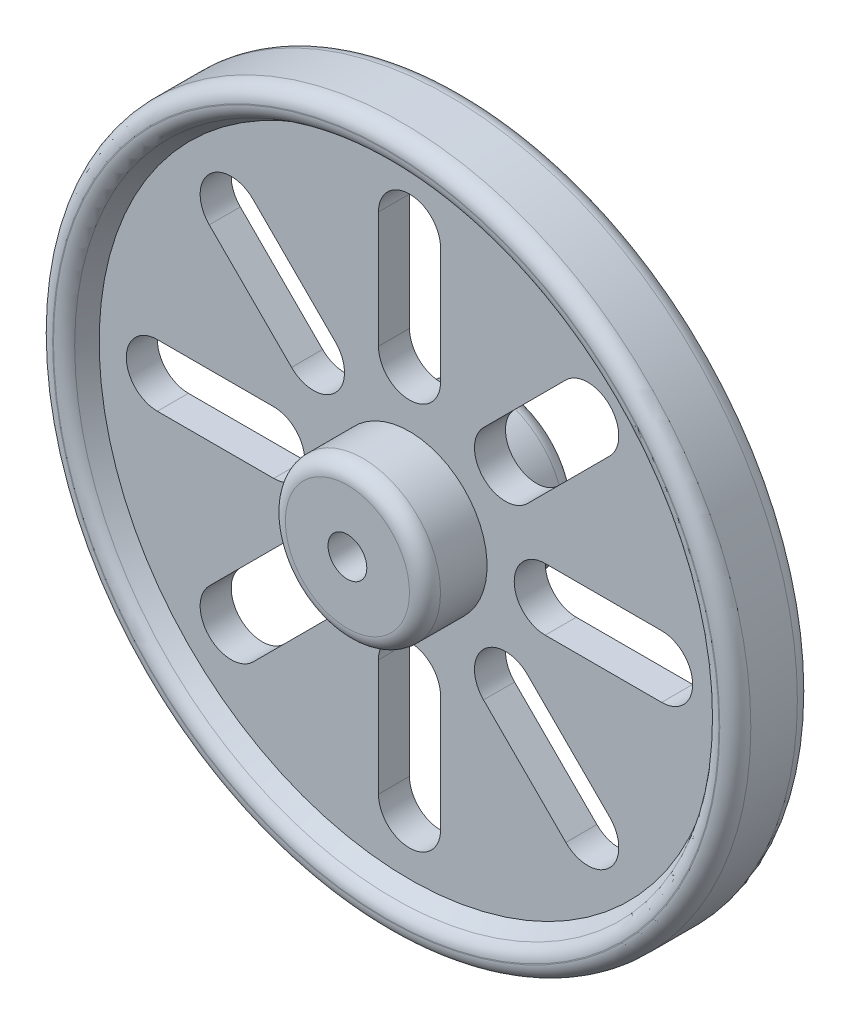
from build123d import *

# Parameters (mm, degrees)
SKETCH1_R                = 10
BOSS_EXTRUDE1_DEPTH      = 10
CUT_EXTRUDE1_DEPTH       = 10
CIRPATTERN1_COUNT        = 8
FILLET1_R                = 2
F_5_0_5_DIAMETER_HOLE1_D = 5


with BuildPart() as part:
    # Sketch1 → Boss-Extrude1 (new, symmetric)
    with BuildSketch(Plane.XY):
        Circle(SKETCH1_R)
    extrude(amount=BOSS_EXTRUDE1_DEPTH, both=True)

    # Sketch2 → Revolve1 (revolve)
    with BuildSketch(Plane(origin=(0, 0, 0), x_dir=(0, 0, -1), z_dir=(1, 0, 0)), mode=Mode.PRIVATE) as revolve1_sk:
        Polygon((-5, 45), (5, 45), (5, 41.732050808), (2, 40), (2, 10), (-2, 10), (-2, 40), (-5, 41.732050808), align=None)
    revolve(revolve1_sk.sketch.rotate(Axis((0, 0, 10), (0, 0, -1)), 90), axis=Axis((0, 0, 10), (0, 0, -1)))

    # Sketch3 → Cut-Extrude1 (cut)
    with BuildSketch(Plane.XY.offset(2)):
        with BuildLine():
            Line((4, 32.5), (4, 17.5))
            ThreePointArc((4, 17.5), (0, 13.5), (-4, 17.5))
            Line((-4, 17.5), (-4, 32.5))
            ThreePointArc((-4, 32.5), (0, 36.5), (4, 32.5))
        make_face()
    cut_extrude1 = extrude(amount=-CUT_EXTRUDE1_DEPTH, mode=Mode.SUBTRACT)

    # CirPattern1: Cut-Extrude1 ×8 about axis
    cirpattern1_axis = Axis((0, 0, 0), (0, 0, 1))
    for i in range(1, CIRPATTERN1_COUNT):
        add(cut_extrude1.rotate(cirpattern1_axis, i * 360 / CIRPATTERN1_COUNT), mode=Mode.SUBTRACT)

    # Fillet1
    fillet1_edges = [part.edges().sort_by_distance(p)[0] for p in [
        (-10, 0, -10),
        (-10, 0, 10),
        (-41.732050808, 0, -5),
        (-41.732050808, 0, 5),
        (-45, 0, 5),
        (-45, 0, -5),
    ]]
    fillet(fillet1_edges, radius=FILLET1_R)

    # Ø5.0 (5) Diameter Hole1 (through all)
    with Locations(Plane.XY.offset(10)):
        with Locations((0, 0)):
            Hole(F_5_0_5_DIAMETER_HOLE1_D / 2)


solid = part.part
